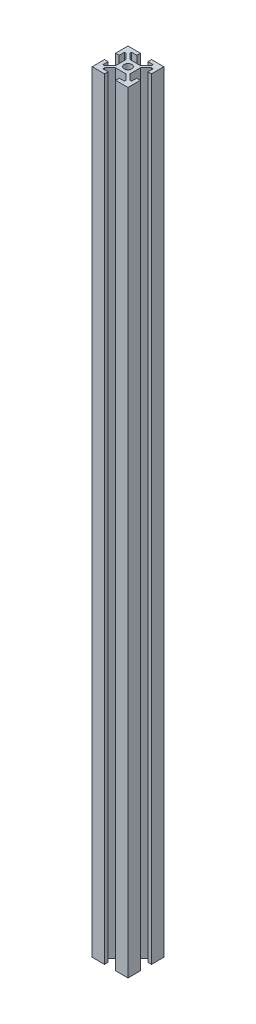
from build123d import *

# Parameters (mm, degrees)
SKETCH_1_R          = 2.15
EXTRUDE_1_DEPTH     = 430
SKETCH_3_R          = 3
CUT_EXTRUDE_1_DEPTH = 26


with BuildPart() as part:
    # 스케치1 → 보스-돌출1 (new body)
    with BuildSketch(Plane(origin=(0, 0, 0), x_dir=(1, 0, 0), z_dir=(0, 1, 0))):
        Polygon((3.1, 8), (6, 8), (6, 7), (3, 4), (0, 4), (-3, 4), (-6, 7), (-6, 8), (-3.1, 8), (-3.1, 9.998992087), (-10.001007855, 9.998992087), (-10.001007855, 3.1), (-8, 3.1), (-8, 6), (-7, 6), (-4, 3), (-4, 0), (-4, -3), (-7, -6), (-8, -6), (-8, -3.1), (-10.001007855, -3.1), (-10.001007855, -9.998992087), (-3.1, -9.998992087), (-3.1, -8), (-6, -8), (-6, -7), (-3, -4), (0, -4), (3, -4), (6, -7), (6, -8), (3.1, -8), (3.1, -9.998992087), (10.001007855, -9.998992087), (10.001007855, -3.1), (8, -3.1), (8, -6), (7, -6), (4, -3), (4, 0), (4, 3), (7, 6), (8, 6), (8, 3.1), (10.001007855, 3.1), (10.001007855, 9.998992087), (3.1, 9.998992087), align=None)
        with Locations(Location((0, 0, 0), (0, 0, 270))):
            Circle(SKETCH_1_R, mode=Mode.SUBTRACT)
    extrude(amount=EXTRUDE_1_DEPTH)

    # 스케치3 → 컷-돌출1 (cut)
    with BuildSketch(Plane(origin=(10.001007855, 0, 0), x_dir=(0, 0, -1), z_dir=(1, 0, 0))):
        with Locations((0, 215)):
            Circle(SKETCH_3_R)
    extrude(amount=-CUT_EXTRUDE_1_DEPTH, mode=Mode.SUBTRACT)


solid = part.part
